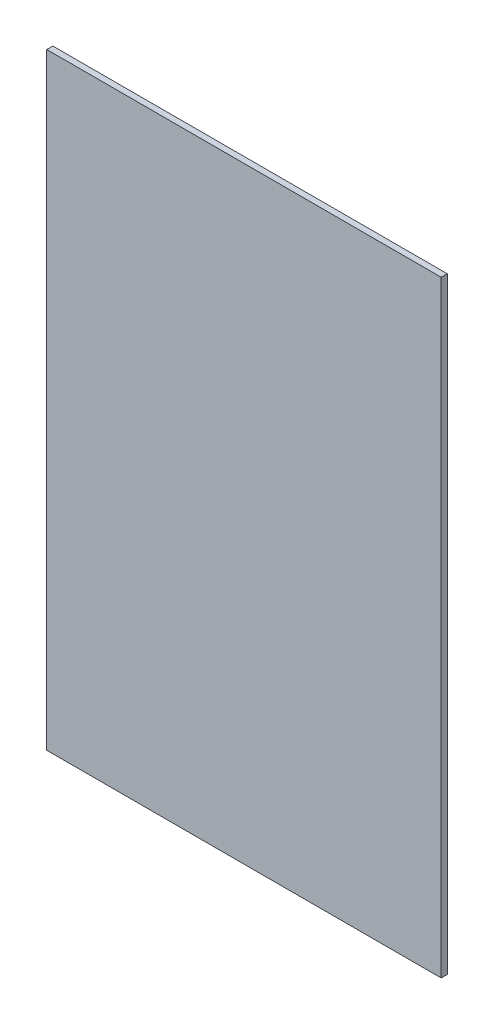
from build123d import *

# Parameters (mm, degrees)
ESQUISSE1_W        = 650
ESQUISSE1_H        = 1000
BOSS_EXTRU_2_DEPTH = 10


with BuildPart() as part:
    # Esquisse1 → Boss.-Extru.2 (new body)
    with BuildSketch(Plane.XY):
        with Locations((325, -500)):
            Rectangle(ESQUISSE1_W, ESQUISSE1_H)
    extrude(amount=BOSS_EXTRU_2_DEPTH)


solid = part.part
